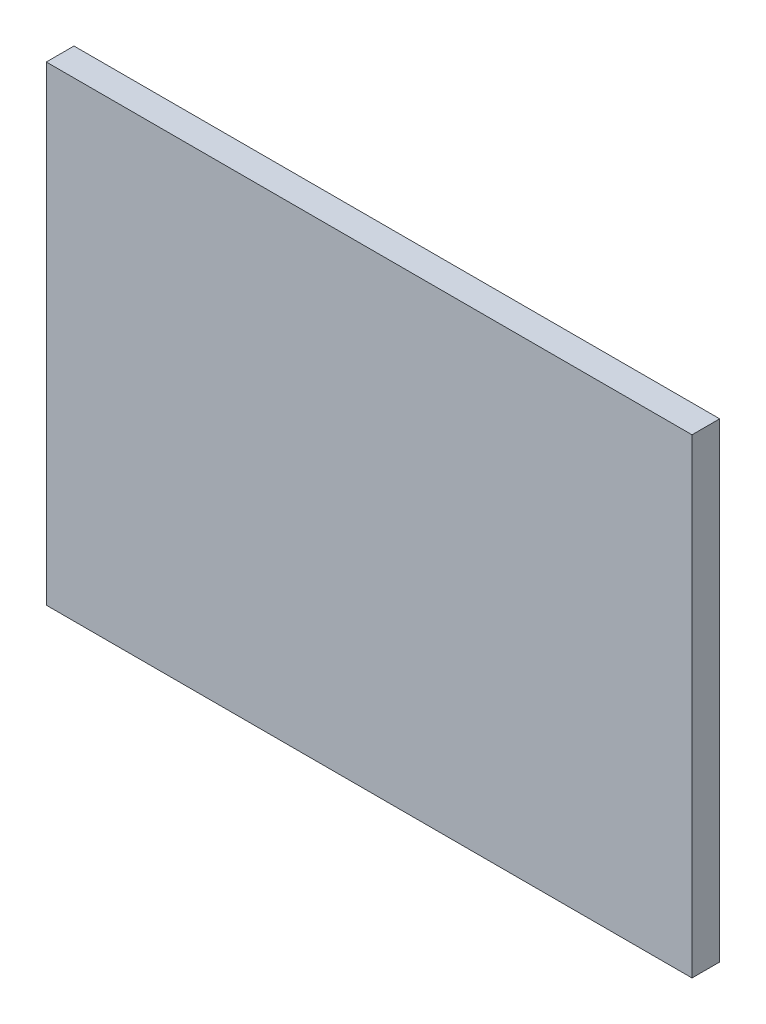
from build123d import *

# Parameters (mm, degrees)
SKETCH1_W           = 70
SKETCH1_H           = 51
BOSS_EXTRUDE1_DEPTH = 3


with BuildPart() as part:
    # Sketch1 → Boss-Extrude1 (new body)
    with BuildSketch(Plane.XY):
        Rectangle(SKETCH1_W, SKETCH1_H)
    extrude(amount=BOSS_EXTRUDE1_DEPTH)


solid = part.part
